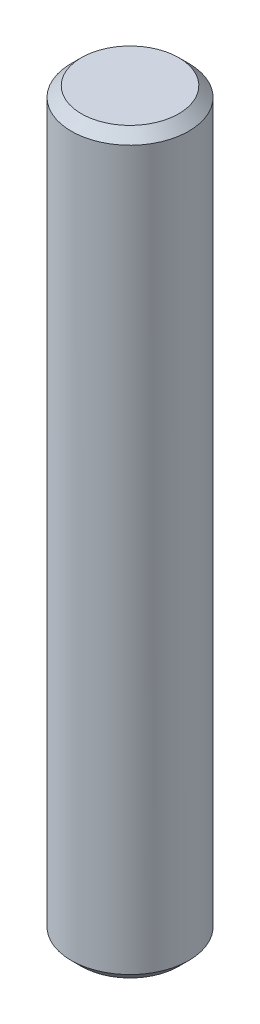
from build123d import *

# Parameters (mm, degrees)
ESTRUSIONE1_DEPTH      = 32
ESTRUSIONE1_DEPTH_BACK = 12
SCHIZZO1_R             = 3.5
SMUSSO1_SIZE           = 0.6


with BuildPart() as part:
    # Schizzo1 → Estrusione1 (new, two sides: drawn at the far end of the back side and taken through both)
    with BuildSketch(Plane(origin=(0, 0, 0), x_dir=(1, 0, 0), z_dir=(0, 1, 0)).offset(-ESTRUSIONE1_DEPTH_BACK)):
        with Locations(Location((0, 0, 0), (0, 0, 270))):
            Circle(SCHIZZO1_R)
    extrude(amount=ESTRUSIONE1_DEPTH + ESTRUSIONE1_DEPTH_BACK)

    # Smusso1
    smusso1_edges = [part.edges().sort_by_distance(p)[0] for p in [
        (0, -12, -3.5),
        (0, 32, -3.5),
    ]]
    chamfer(smusso1_edges, length=SMUSSO1_SIZE)


solid = part.part
